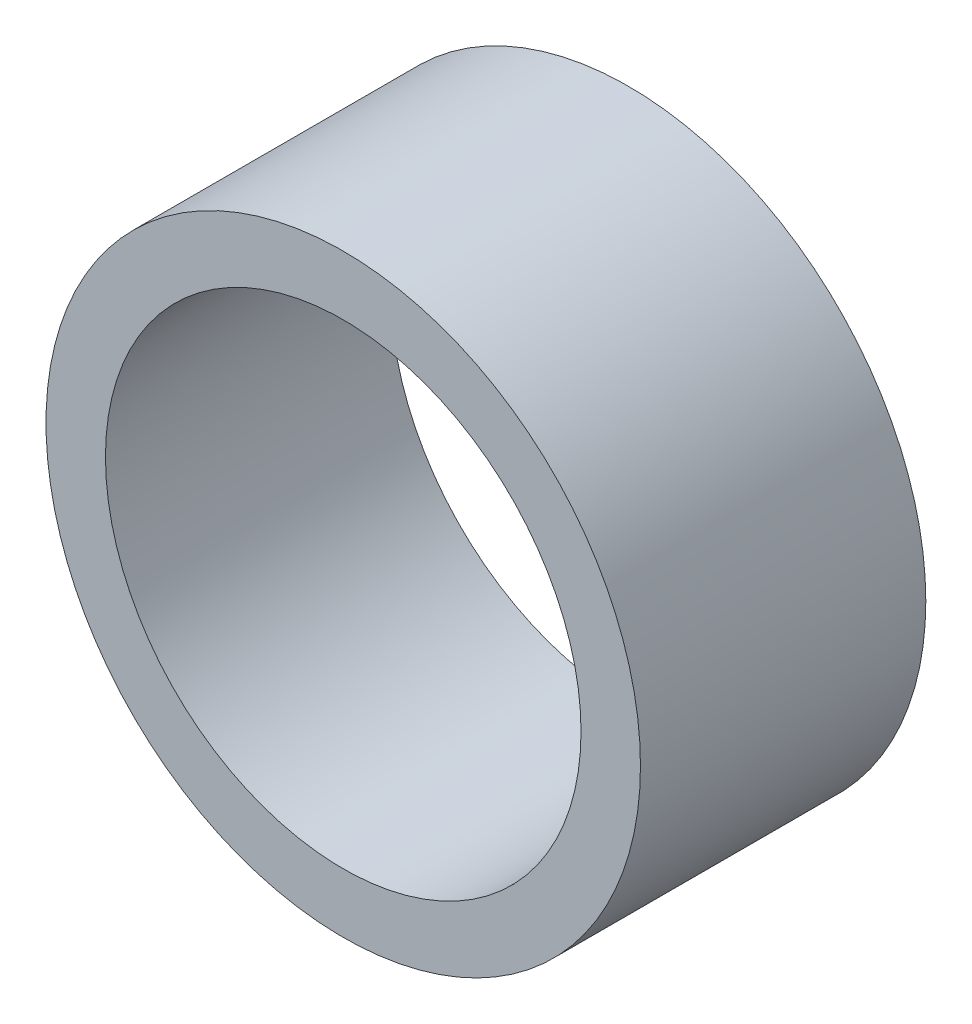
from build123d import *

# Parameters (mm, degrees)
ESQUISSE1_R        = 12.5
ESQUISSE1_R_2      = 10
BOSS_EXTRU_1_DEPTH = 12


with BuildPart() as part:
    # Esquisse1 → Boss.-Extru.1 (new body)
    with BuildSketch(Plane.XY):
        Circle(ESQUISSE1_R)
        Circle(ESQUISSE1_R_2, mode=Mode.SUBTRACT)
    extrude(amount=BOSS_EXTRU_1_DEPTH)


solid = part.part
